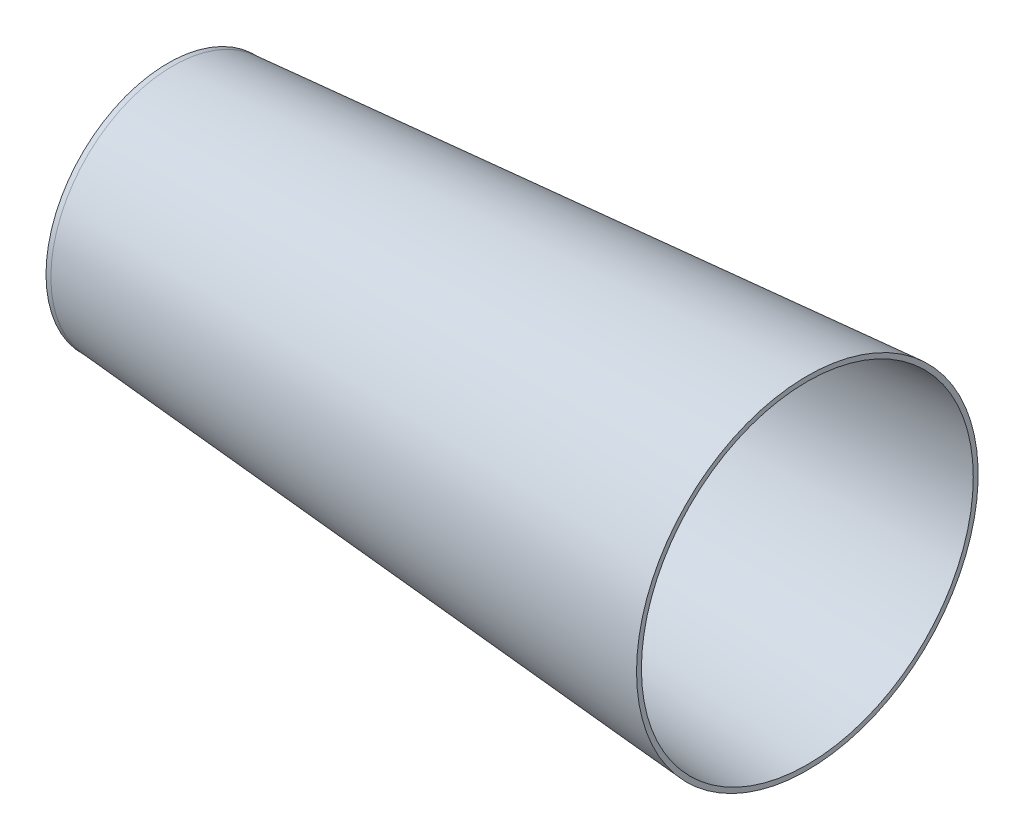
from build123d import *


with BuildPart() as part:
    # Esquisse1 → Révolution1 (revolve)
    with BuildSketch(Plane.XY, mode=Mode.PRIVATE) as r_volution1_sk:
        Polygon((-37.273714645, 25), (92.726285355, 35), (92.726285355, 34), (-37.273714645, 24), (-37.273714645, 0), (-38.273714645, 0), (-38.273714645, 25), align=None)
    revolve(r_volution1_sk.sketch.rotate(Axis((-48.948507427, 0, 0), (1, 0, 0)), 90), axis=Axis((-48.948507427, 0, 0), (1, 0, 0)))


solid = part.part
